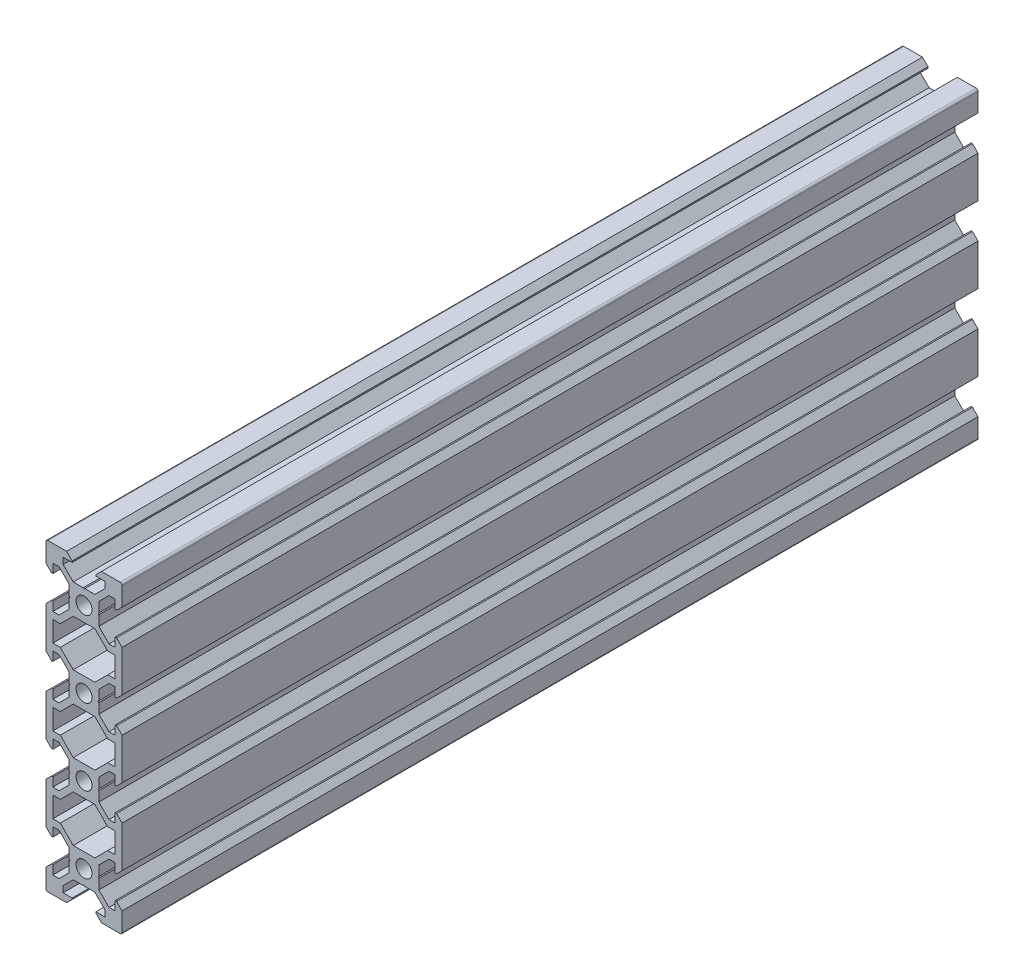
from build123d import *

# Parameters (mm, degrees)
SKETCH1_R           = 2.1
BOSS_EXTRUDE1_DEPTH = 225


with BuildPart() as part:
    # Sketch1 → Boss-Extrude1 (new body)
    with BuildSketch(Plane.XY):
        with BuildLine():
            Line((4.58, -40), (9.5, -40))
            ThreePointArc((9.5, -40), (9.853553391, -39.853553391), (10, -39.5))
            Line((10, -39.5), (10, -34.58))
            Line((10, -34.58), (8.545, -33.125))
            Line((8.545, -33.125), (8.2, -33.125))
            Line((8.2, -33.125), (8.2, -35.5))
            Line((8.2, -35.5), (6.560660172, -35.5))
            Line((6.560660172, -35.5), (3.9, -32.839339828))
            Line((3.9, -32.839339828), (3.9, -30.21))
            Line((3.9, -30.21), (3.69, -30))
            Line((3.69, -30), (3.9, -29.79))
            Line((3.9, -29.79), (3.9, -27.160660172))
            Line((3.9, -27.160660172), (6.560660172, -24.5))
            Line((6.560660172, -24.5), (8.2, -24.5))
            Line((8.2, -24.5), (8.2, -26.875))
            Line((8.2, -26.875), (8.545, -26.875))
            Line((8.545, -26.875), (10, -25.42))
            Line((10, -25.42), (10, -14.58))
            Line((10, -14.58), (8.545, -13.125))
            Line((8.545, -13.125), (8.2, -13.125))
            Line((8.2, -13.125), (8.2, -15.5))
            Line((8.2, -15.5), (6.560660172, -15.5))
            Line((6.560660172, -15.5), (3.9, -12.839339828))
            Line((3.9, -12.839339828), (3.9, -10.21))
            Line((3.9, -10.21), (3.69, -10))
            Line((3.69, -10), (3.9, -9.79))
            Line((3.9, -9.79), (3.9, -7.160660172))
            Line((3.9, -7.160660172), (6.560660172, -4.5))
            Line((6.560660172, -4.5), (8.2, -4.5))
            Line((8.2, -4.5), (8.2, -6.875))
            Line((8.2, -6.875), (8.545, -6.875))
            Line((8.545, -6.875), (10, -5.42))
            Line((10, -5.42), (10, 5.42))
            Line((10, 5.42), (8.545, 6.875))
            Line((8.545, 6.875), (8.2, 6.875))
            Line((8.2, 6.875), (8.2, 4.5))
            Line((8.2, 4.5), (6.560660172, 4.5))
            Line((6.560660172, 4.5), (3.9, 7.160660172))
            Line((3.9, 7.160660172), (3.9, 9.79))
            Line((3.9, 9.79), (3.69, 10))
            Line((3.69, 10), (3.9, 10.21))
            Line((3.9, 10.21), (3.9, 12.839339828))
            Line((3.9, 12.839339828), (6.560660172, 15.5))
            Line((6.560660172, 15.5), (8.2, 15.5))
            Line((8.2, 15.5), (8.2, 13.125))
            Line((8.2, 13.125), (8.545, 13.125))
            Line((8.545, 13.125), (10, 14.58))
            Line((10, 14.58), (10, 25.42))
            Line((10, 25.42), (8.545, 26.875))
            Line((8.545, 26.875), (8.2, 26.875))
            Line((8.2, 26.875), (8.2, 24.5))
            Line((8.2, 24.5), (6.560660172, 24.5))
            Line((6.560660172, 24.5), (3.9, 27.160660172))
            Line((3.9, 27.160660172), (3.9, 29.79))
            Line((3.9, 29.79), (3.69, 30))
            Line((3.69, 30), (3.9, 30.21))
            Line((3.9, 30.21), (3.9, 32.839339828))
            Line((3.9, 32.839339828), (6.560660172, 35.5))
            Line((6.560660172, 35.5), (8.2, 35.5))
            Line((8.2, 35.5), (8.2, 33.125))
            Line((8.2, 33.125), (8.545, 33.125))
            Line((8.545, 33.125), (10, 34.58))
            Line((10, 34.58), (10, 39.5))
            ThreePointArc((10, 39.5), (9.853553391, 39.853553391), (9.5, 40))
            Line((9.5, 40), (4.58, 40))
            Line((4.58, 40), (3.125, 38.545))
            Line((3.125, 38.545), (3.125, 38.2))
            Line((3.125, 38.2), (5.5, 38.2))
            Line((5.5, 38.2), (5.5, 36.560660172))
            Line((5.5, 36.560660172), (2.839339828, 33.9))
            Line((2.839339828, 33.9), (0.21, 33.9))
            Line((0.21, 33.9), (0, 33.69))
            Line((0, 33.69), (-0.21, 33.9))
            Line((-0.21, 33.9), (-2.839339828, 33.9))
            Line((-2.839339828, 33.9), (-5.5, 36.560660172))
            Line((-5.5, 36.560660172), (-5.5, 38.2))
            Line((-5.5, 38.2), (-3.125, 38.2))
            Line((-3.125, 38.2), (-3.125, 38.545))
            Line((-3.125, 38.545), (-4.58, 40))
            Line((-4.58, 40), (-9.5, 40))
            ThreePointArc((-9.5, 40), (-9.853553391, 39.853553391), (-10, 39.5))
            Line((-10, 39.5), (-10, 34.58))
            Line((-10, 34.58), (-8.545, 33.125))
            Line((-8.545, 33.125), (-8.2, 33.125))
            Line((-8.2, 33.125), (-8.2, 35.5))
            Line((-8.2, 35.5), (-6.560660172, 35.5))
            Line((-6.560660172, 35.5), (-3.9, 32.839339828))
            Line((-3.9, 32.839339828), (-3.9, 30.21))
            Line((-3.9, 30.21), (-3.69, 30))
            Line((-3.69, 30), (-3.9, 29.79))
            Line((-3.9, 29.79), (-3.9, 27.160660172))
            Line((-3.9, 27.160660172), (-6.560660172, 24.5))
            Line((-6.560660172, 24.5), (-8.2, 24.5))
            Line((-8.2, 24.5), (-8.2, 26.875))
            Line((-8.2, 26.875), (-8.545, 26.875))
            Line((-8.545, 26.875), (-10, 25.42))
            Line((-10, 25.42), (-10, 14.58))
            Line((-10, 14.58), (-8.545, 13.125))
            Line((-8.545, 13.125), (-8.2, 13.125))
            Line((-8.2, 13.125), (-8.2, 15.5))
            Line((-8.2, 15.5), (-6.560660172, 15.5))
            Line((-6.560660172, 15.5), (-3.9, 12.839339828))
            Line((-3.9, 12.839339828), (-3.9, 10.21))
            Line((-3.9, 10.21), (-3.69, 10))
            Line((-3.69, 10), (-3.9, 9.79))
            Line((-3.9, 9.79), (-3.9, 7.160660172))
            Line((-3.9, 7.160660172), (-6.560660172, 4.5))
            Line((-6.560660172, 4.5), (-8.2, 4.5))
            Line((-8.2, 4.5), (-8.2, 6.875))
            Line((-8.2, 6.875), (-8.545, 6.875))
            Line((-8.545, 6.875), (-10, 5.42))
            Line((-10, 5.42), (-10, -5.42))
            Line((-10, -5.42), (-8.545, -6.875))
            Line((-8.545, -6.875), (-8.2, -6.875))
            Line((-8.2, -6.875), (-8.2, -4.5))
            Line((-8.2, -4.5), (-6.560660172, -4.5))
            Line((-6.560660172, -4.5), (-3.9, -7.160660172))
            Line((-3.9, -7.160660172), (-3.9, -9.79))
            Line((-3.9, -9.79), (-3.69, -10))
            Line((-3.69, -10), (-3.9, -10.21))
            Line((-3.9, -10.21), (-3.9, -12.839339828))
            Line((-3.9, -12.839339828), (-6.560660172, -15.5))
            Line((-6.560660172, -15.5), (-8.2, -15.5))
            Line((-8.2, -15.5), (-8.2, -13.125))
            Line((-8.2, -13.125), (-8.545, -13.125))
            Line((-8.545, -13.125), (-10, -14.58))
            Line((-10, -14.58), (-10, -25.42))
            Line((-10, -25.42), (-8.545, -26.875))
            Line((-8.545, -26.875), (-8.2, -26.875))
            Line((-8.2, -26.875), (-8.2, -24.5))
            Line((-8.2, -24.5), (-6.560660172, -24.5))
            Line((-6.560660172, -24.5), (-3.9, -27.160660172))
            Line((-3.9, -27.160660172), (-3.9, -29.79))
            Line((-3.9, -29.79), (-3.69, -30))
            Line((-3.69, -30), (-3.9, -30.21))
            Line((-3.9, -30.21), (-3.9, -32.839339828))
            Line((-3.9, -32.839339828), (-6.560660172, -35.5))
            Line((-6.560660172, -35.5), (-8.2, -35.5))
            Line((-8.2, -35.5), (-8.2, -33.125))
            Line((-8.2, -33.125), (-8.545, -33.125))
            Line((-8.545, -33.125), (-10, -34.58))
            Line((-10, -34.58), (-10, -39.5))
            ThreePointArc((-10, -39.5), (-9.853553391, -39.853553391), (-9.5, -40))
            Line((-9.5, -40), (-4.58, -40))
            Line((-4.58, -40), (-3.125, -38.545))
            Line((-3.125, -38.545), (-3.125, -38.2))
            Line((-3.125, -38.2), (-5.5, -38.2))
            Line((-5.5, -38.2), (-5.5, -36.560660172))
            Line((-5.5, -36.560660172), (-2.839339828, -33.9))
            Line((-2.839339828, -33.9), (-0.21, -33.9))
            Line((-0.21, -33.9), (0, -33.69))
            Line((0, -33.69), (0.21, -33.9))
            Line((0.21, -33.9), (2.839339828, -33.9))
            Line((2.839339828, -33.9), (5.5, -36.560660172))
            Line((5.5, -36.560660172), (5.5, -38.2))
            Line((5.5, -38.2), (3.125, -38.2))
            Line((3.125, -38.2), (3.125, -38.545))
            Line((3.125, -38.545), (4.58, -40))
        make_face()
        with Locations((0, -30)):
            Circle(SKETCH1_R, mode=Mode.SUBTRACT)
        Polygon((-6.239339828, -22.7), (-8.2, -22.7), (-8.2, -17.3), (-6.239339828, -17.3), (-2.839339828, -13.9), (2.839339828, -13.9), (6.239339828, -17.3), (8.2, -17.3), (8.2, -22.7), (6.239339828, -22.7), (2.839339828, -26.1), (-2.839339828, -26.1), align=None, mode=Mode.SUBTRACT)
        with Locations((0, -10)):
            Circle(SKETCH1_R, mode=Mode.SUBTRACT)
        Polygon((-6.239339828, -2.7), (-8.2, -2.7), (-8.2, 2.7), (-6.239339828, 2.7), (-2.839339828, 6.1), (2.839339828, 6.1), (6.239339828, 2.7), (8.2, 2.7), (8.2, -2.7), (6.239339828, -2.7), (2.839339828, -6.1), (-2.839339828, -6.1), align=None, mode=Mode.SUBTRACT)
        with Locations((0, 10)):
            Circle(SKETCH1_R, mode=Mode.SUBTRACT)
        Polygon((-6.239339828, 17.3), (-8.2, 17.3), (-8.2, 22.7), (-6.239339828, 22.7), (-2.839339828, 26.1), (2.839339828, 26.1), (6.239339828, 22.7), (8.2, 22.7), (8.2, 17.3), (6.239339828, 17.3), (2.839339828, 13.9), (-2.839339828, 13.9), align=None, mode=Mode.SUBTRACT)
        with Locations((0, 30)):
            Circle(SKETCH1_R, mode=Mode.SUBTRACT)
    extrude(amount=BOSS_EXTRUDE1_DEPTH)


solid = part.part
